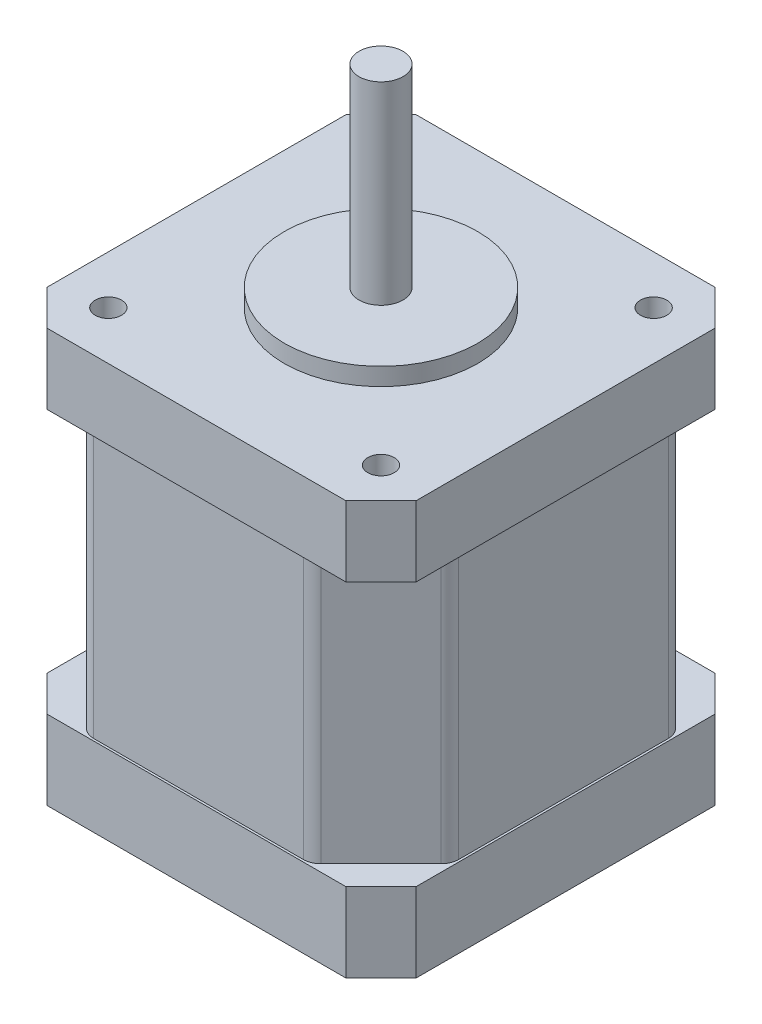
from build123d import *

# Parameters (mm, degrees)
SKETCH1_R           = 1.5
BOSS_EXTRUDE1_DEPTH = 8
BOSS_EXTRUDE2_DEPTH = 30
FILLET1_R           = 2
BOSS_EXTRUDE3_DEPTH = 9
SKETCH4_R           = 11
BOSS_EXTRUDE4_DEPTH = 2
SKETCH5_R           = 2.5
BOSS_EXTRUDE5_DEPTH = 22
BOSS_EXTRUDE6_START = 10
SKETCH6_R           = 2.5
BOSS_EXTRUDE6_DEPTH = 10


with BuildPart() as part:
    # Sketch1 → Boss-Extrude1 (new body)
    with BuildSketch(Plane(origin=(0, 0, 0), x_dir=(1, 0, 0), z_dir=(0, 1, 0))):
        Polygon((-17, 21), (17, 21), (21, 17), (21, -17), (17, -21), (-17, -21), (-21, -17), (-21, 17), align=None)
        with Locations(Location((-15.5, 15.5, 0), (0, 0, 270))):
            Circle(SKETCH1_R, mode=Mode.SUBTRACT)
        with Locations(Location((-15.5, -15.5, 0), (0, 0, 270))):
            Circle(SKETCH1_R, mode=Mode.SUBTRACT)
        with Locations(Location((15.5, -15.5, 0), (0, 0, 270))):
            Circle(SKETCH1_R, mode=Mode.SUBTRACT)
        with Locations(Location((15.5, 15.5, 0), (0, 0, 270))):
            Circle(SKETCH1_R, mode=Mode.SUBTRACT)
    extrude(amount=BOSS_EXTRUDE1_DEPTH)

    # Sketch2 → Boss-Extrude2 (add)
    with BuildSketch(Plane.XZ):
        Polygon((-12.75, 20.75), (12.75, 20.75), (20.75, 12.75), (20.75, -12.75), (12.75, -20.75), (-12.75, -20.75), (-20.75, -12.75), (-20.75, 12.75), align=None)
    extrude(amount=BOSS_EXTRUDE2_DEPTH)

    # Fillet1
    fillet1_edges = [part.edges().sort_by_distance(p)[0] for p in [
        (20.75, -15, 12.75),
        (12.75, -15, 20.75),
        (-12.75, -15, 20.75),
        (-20.75, -15, 12.75),
        (-20.75, -15, -12.75),
        (-12.75, -15, -20.75),
        (12.75, -15, -20.75),
        (20.75, -15, -12.75),
    ]]
    fillet(fillet1_edges, radius=FILLET1_R)

    # Sketch3 → Boss-Extrude3 (add)
    with BuildSketch(Plane.XZ.offset(30)):
        Polygon((-21, 17), (-21, -17), (-17, -21), (17, -21), (21, -17), (21, 17), (17, 21), (-17, 21), align=None)
    extrude(amount=BOSS_EXTRUDE3_DEPTH)

    # Sketch4 → Boss-Extrude4 (add)
    with BuildSketch(Plane(origin=(0, 8, 0), x_dir=(1, 0, 0), z_dir=(0, 1, 0))):
        with Locations(Location((0, 0, 0), (0, 0, 90))):
            Circle(SKETCH4_R)
    extrude(amount=BOSS_EXTRUDE4_DEPTH)

    # Sketch5 → Boss-Extrude5 (add)
    with BuildSketch(Plane(origin=(0, 10, 0), x_dir=(1, 0, 0), z_dir=(0, 1, 0))):
        with Locations(Location((0, 0, 0), (0, 0, 270))):
            Circle(SKETCH5_R)
    extrude(amount=BOSS_EXTRUDE5_DEPTH)

    # Sketch6 → Boss-Extrude6 (add)
    with BuildSketch(Plane.XZ.offset(39).offset(BOSS_EXTRUDE6_START)):
        with Locations(Location((0, 0, 0), (0, 0, 90))):
            Circle(SKETCH6_R)
    extrude(amount=-BOSS_EXTRUDE6_DEPTH)


solid = part.part
